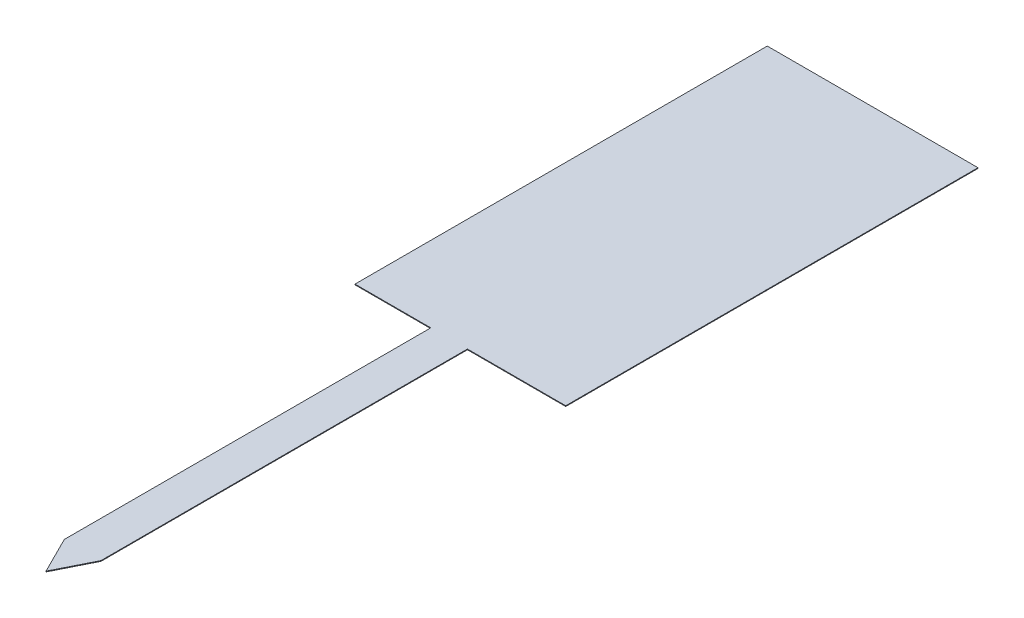
from build123d import *

# Parameters (mm, degrees)
BOSS_EXTRUDE3_DEPTH = 0.075


with BuildPart() as part:
    # Sketch5 → Boss-Extrude3 (new body)
    with BuildSketch(Plane(origin=(-4.151565836, 0, 2.12145133), x_dir=(1, 0, 0), z_dir=(0, 1, 0))):
        Polygon((-6.122064727, 24.62145133), (16.877935273, 24.62145133), (16.877935273, -20.37854867), (6.151565836, -20.37854867), (6.151565836, -60.37854867), (4.151565836, -64.37854867), (2.151565836, -60.37854867), (2.151565836, -20.37854867), (-6.122064727, -20.37854867), align=None)
    extrude(amount=BOSS_EXTRUDE3_DEPTH)


solid = part.part
